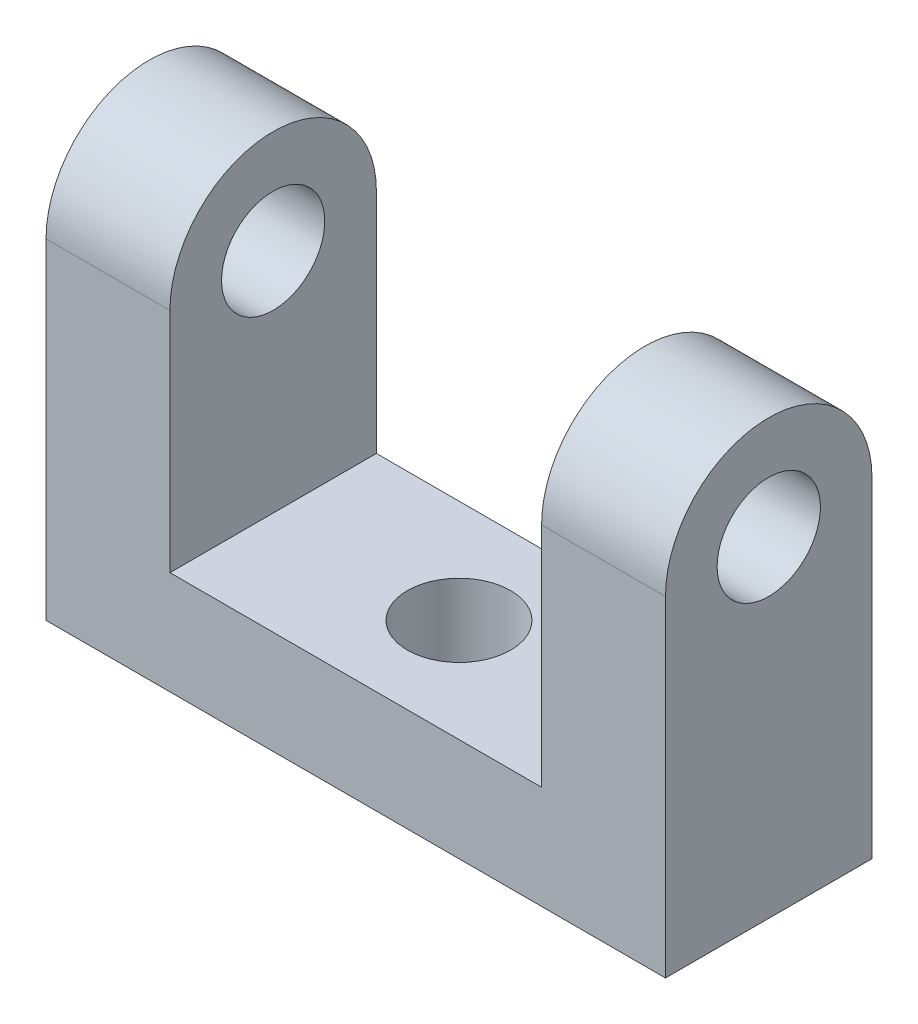
from build123d import *

# Parameters (mm, degrees)
SKETCH1_R           = 3.175
BOSS_EXTRUDE1_DEPTH = 38.1
SKETCH2_W           = 22.86
SKETCH2_H           = 20.32
CUT_EXTRUDE1_DEPTH  = 25.4
SKETCH3_R           = 3.175
CUT_EXTRUDE2_DEPTH  = 25.4


with BuildPart() as part:
    # Sketch1 → Boss-Extrude1 (new body)
    with BuildSketch(Plane(origin=(0, 0, 0), x_dir=(0, 0, -1), z_dir=(1, 0, 0))):
        with BuildLine():
            Line((-6.35, 0), (6.35, 0))
            Line((6.35, 0), (6.35, 20.32))
            ThreePointArc((6.35, 20.32), (0, 26.67), (-6.35, 20.32))
            Line((-6.35, 20.32), (-6.35, 0))
        make_face()
        with Locations(Location((0, 20.32, 0), (0, 0, 180))):
            Circle(SKETCH1_R, mode=Mode.SUBTRACT)
    extrude(amount=BOSS_EXTRUDE1_DEPTH)

    # Sketch2 → Cut-Extrude1 (cut)
    with BuildSketch(Plane.XY.offset(6.35)):
        with Locations((19.05, 16.51)):
            Rectangle(SKETCH2_W, SKETCH2_H)
    extrude(amount=-CUT_EXTRUDE1_DEPTH, mode=Mode.SUBTRACT)

    # Sketch3 → Cut-Extrude2 (cut)
    with BuildSketch(Plane(origin=(0, 6.35, 0), x_dir=(1, 0, 0), z_dir=(0, 1, 0))):
        with Locations(Location((19.05, 0, 0), (0, 0, 180))):
            Circle(SKETCH3_R)
    extrude(amount=-CUT_EXTRUDE2_DEPTH, mode=Mode.SUBTRACT)


solid = part.part
